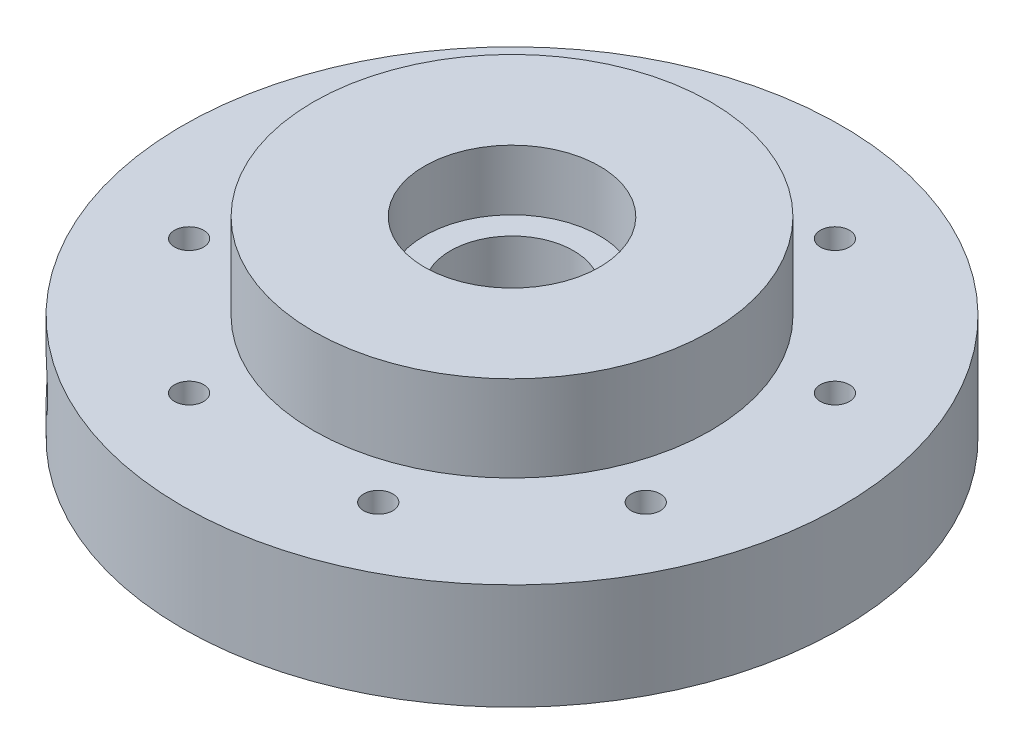
from build123d import *

# Parameters (mm, degrees)
SKETCH1_R                           = 50.8
SKETCH1_R_2                         = 9.5
BODY_AND_CENTER_HOLE_DEPTH          = 29.584375
SKETCH5_R                           = 13.5
BIG_SEAL_CUT_DEPTH                  = 9.3
SKETCH6_R                           = 2.25
IMPELLER_HOUSING_BOLT_HOLES_DEPTH   = 38
IMPELLER_HOUSING_BOLT_PATTERN_COUNT = 8
IMPELLER_START                      = -13.25
SKETCH7_R                           = 50.8
SKETCH7_R_2                         = 30.626685
IMPELLER_RECESS_DEPTH               = 13.25
SKETCH8_R                           = 3
BIG_4_BOLT_HOLE_DEPTH               = 14.334375
BIG_BOLT_PATTERN_COUNT              = 4
VENT_LINE_DEPTH                     = 100
VENT_LINE_DEPTH_BACK                = 13
SKETCH9_R                           = 1.5875
SKETCH11_R                          = 4.1671875
PRESSURE_TAP_DEPTH                  = 9


with BuildPart() as part:
    # Sketch1 → body and center hole (new body)
    with BuildSketch(Plane(origin=(0, 0, 0), x_dir=(1, 0, 0), z_dir=(0, 1, 0))):
        with Locations(Location((0, 0, 0), (0, 0, 270))):
            Circle(SKETCH1_R)
        with Locations(Location((0, 0, 0), (0, 0, 270))):
            Circle(SKETCH1_R_2, mode=Mode.SUBTRACT)
    extrude(amount=BODY_AND_CENTER_HOLE_DEPTH)

    # Sketch5 → big seal cut (cut)
    with BuildSketch(Plane(origin=(0, 29.584375, 0), x_dir=(1, 0, 0), z_dir=(0, 1, 0))):
        with Locations(Location((0, 0, 0), (0, 0, 270))):
            Circle(SKETCH5_R)
    extrude(amount=-BIG_SEAL_CUT_DEPTH, mode=Mode.SUBTRACT)

    # Sketch6 → impeller housing bolt holes (cut)
    with BuildSketch(Plane(origin=(0, 29.584375, 0), x_dir=(1, 0, 0), z_dir=(0, 1, 0))):
        with Locations(Location((14.580238773, 35.199810189, 0), (0, 0, 270))):
            Circle(SKETCH6_R)
    impeller_housing_bolt_holes = extrude(amount=-IMPELLER_HOUSING_BOLT_HOLES_DEPTH, mode=Mode.SUBTRACT)

    # impeller housing bolt pattern: impeller housing bolt holes ×8 about axis
    impeller_housing_bolt_pattern_axis = Axis((0, 0, 0), (0, 1, 0))
    for i in range(1, IMPELLER_HOUSING_BOLT_PATTERN_COUNT):
        add(impeller_housing_bolt_holes.rotate(impeller_housing_bolt_pattern_axis, i * 360 / IMPELLER_HOUSING_BOLT_PATTERN_COUNT), mode=Mode.SUBTRACT)

    # Sketch7 → impeller recess (cut)
    with BuildSketch(Plane(origin=(0, 29.584375, 0), x_dir=(1, 0, 0), z_dir=(0, 1, 0)).offset(IMPELLER_START)):
        with Locations(Location((0, 0, 0), (0, 0, 270))):
            Circle(SKETCH7_R)
        with Locations(Location((0, 0, 0), (0, 0, 270))):
            Circle(SKETCH7_R_2, mode=Mode.SUBTRACT)
    extrude(amount=IMPELLER_RECESS_DEPTH, mode=Mode.SUBTRACT)

    # Sketch8 → big 4 bolt hole (cut)
    with BuildSketch(Plane(origin=(0, 0, 0), x_dir=(-1, 0, 0), z_dir=(0, -1, 0))):
        with Locations(Location((0, -25.4, 0), (0, 0, 90))):
            Circle(SKETCH8_R)
    big_4_bolt_hole = extrude(amount=-BIG_4_BOLT_HOLE_DEPTH, mode=Mode.SUBTRACT)

    # big bolt pattern: big 4 bolt hole ×4 about axis
    big_bolt_pattern_axis = Axis((0, 0, 0), (0, 1, 0))
    for i in range(1, BIG_BOLT_PATTERN_COUNT):
        add(big_4_bolt_hole.rotate(big_bolt_pattern_axis, i * 360 / BIG_BOLT_PATTERN_COUNT), mode=Mode.SUBTRACT)

    # Sketch9 → vent line (cut, two sides: drawn at the far end of the back side and taken through both)
    with BuildSketch(Plane(origin=(-10.578679656, 0, 10.578679656), x_dir=(0.7071067811865513, 0, 0.7071067811865438), z_dir=(-0.7071067811865438, 0, 0.7071067811865513)).offset(-VENT_LINE_DEPTH_BACK)):
        with Locations(Location((0, 8.1671875, 0), (0, 0, 180))):
            Circle(SKETCH9_R)
    extrude(amount=VENT_LINE_DEPTH + VENT_LINE_DEPTH_BACK, mode=Mode.SUBTRACT)

    # Sketch11 → pressure tap (cut)
    with BuildSketch(Plane(origin=(-35.921024484, 0, 35.921024484), x_dir=(0.7071067811865512, 0, 0.7071067811865438), z_dir=(-0.7071067811865438, 0, 0.7071067811865512))):
        with Locations((0, 8.1671875)):
            Circle(SKETCH11_R)
    extrude(amount=-PRESSURE_TAP_DEPTH, mode=Mode.SUBTRACT)


solid = part.part
